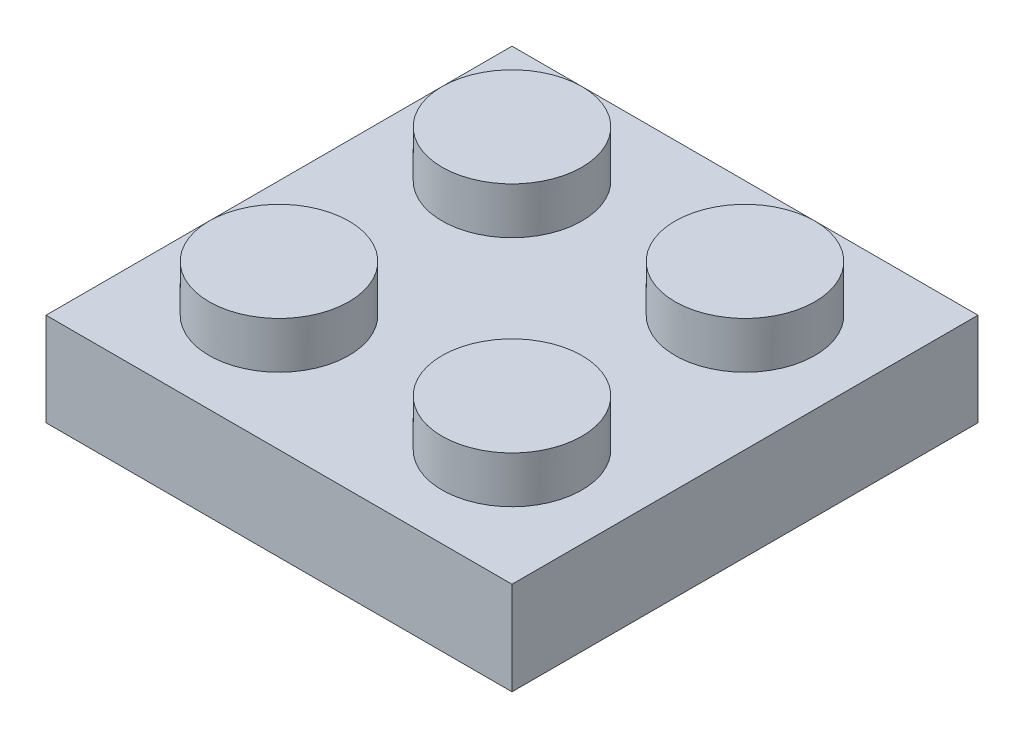
from build123d import *

# Parameters (mm, degrees)
SKETCH1_W            = 16
SKETCH1_H            = 16
BOSS_EXTRUDE1_DEPTH  = 3.2
SKETCH2_R            = 2.4
BOSS_EXTRUDE2_DEPTH  = 1.6
LPATTERN1_COUNT      = 2
LPATTERN1_PITCH      = 8
LPATTERN1_COUNT_DIR2 = 4
LPATTERN1_PITCH_DIR2 = 8
SHELL1_T             = -1.6


with BuildPart() as part:
    # Sketch1 → Boss-Extrude1 (new body)
    with BuildSketch(Plane(origin=(0, 0, 0), x_dir=(1, 0, 0), z_dir=(0, 1, 0))):
        with Locations((8, 8)):
            Rectangle(SKETCH1_W, SKETCH1_H)
    extrude(amount=BOSS_EXTRUDE1_DEPTH)

    # Sketch2 → Boss-Extrude2 (add)
    with BuildSketch(Plane(origin=(0, 3.2, 0), x_dir=(1, 0, 0), z_dir=(0, 1, 0))):
        with Locations(Location((12, 4, 0), (0, 0, 90))):
            Circle(SKETCH2_R)
    boss_extrude2 = extrude(amount=BOSS_EXTRUDE2_DEPTH)

    # LPattern1: Boss-Extrude2 2 × 4, 4 skipped
    with Locations(*[(-i * LPATTERN1_PITCH, 0, -j * LPATTERN1_PITCH_DIR2) for i in range(LPATTERN1_COUNT) for j in range(LPATTERN1_COUNT_DIR2) if (i, j) not in ((0, 0), (0, 2), (0, 3), (1, 2), (1, 3))]):
        add(boss_extrude2)

    # Shell1
    shell1_openings = [part.faces().sort_by_distance(p)[0] for p in [
        (8, 0, -8),
    ]]
    offset(amount=SHELL1_T, openings=shell1_openings, kind=Kind.INTERSECTION)


solid = part.part
